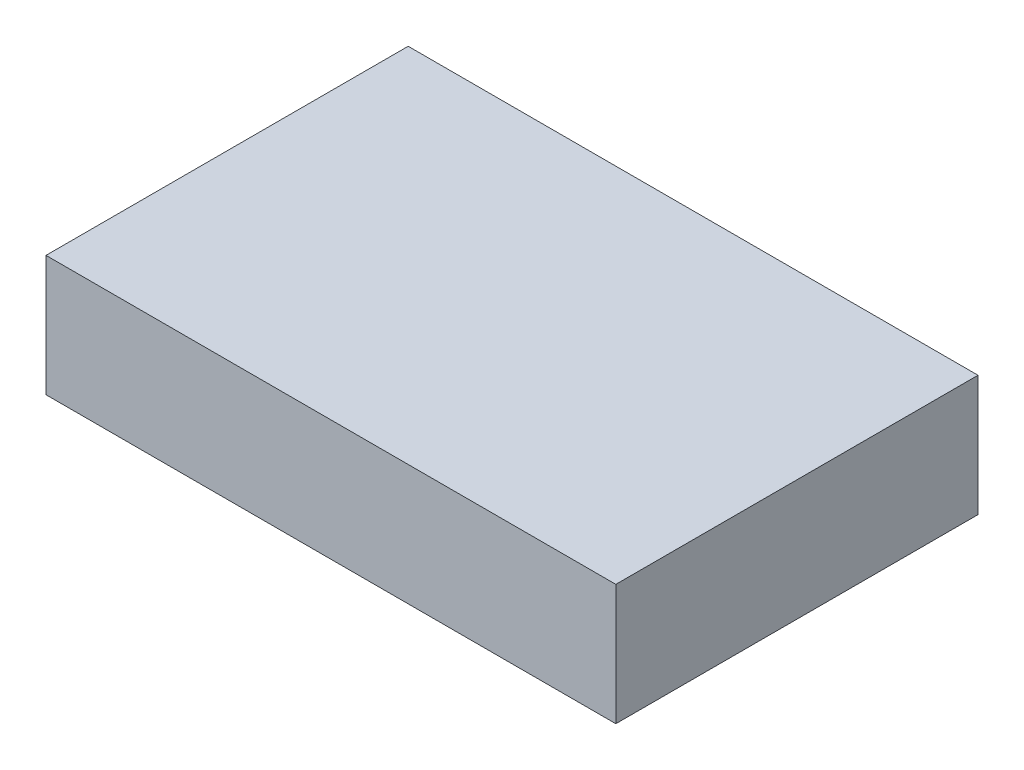
from build123d import *

# Parameters (mm, degrees)
SKETCH1_W           = 29.972
SKETCH1_H           = 19.05
BOSS_EXTRUDE1_DEPTH = 6.35


with BuildPart() as part:
    # Sketch1 → Boss-Extrude1 (new body)
    with BuildSketch(Plane(origin=(0, 0, 0), x_dir=(1, 0, 0), z_dir=(0, 1, 0))):
        with Locations((47.302085404, 6.708082707)):
            Rectangle(SKETCH1_W, SKETCH1_H)
    extrude(amount=BOSS_EXTRUDE1_DEPTH)


solid = part.part
